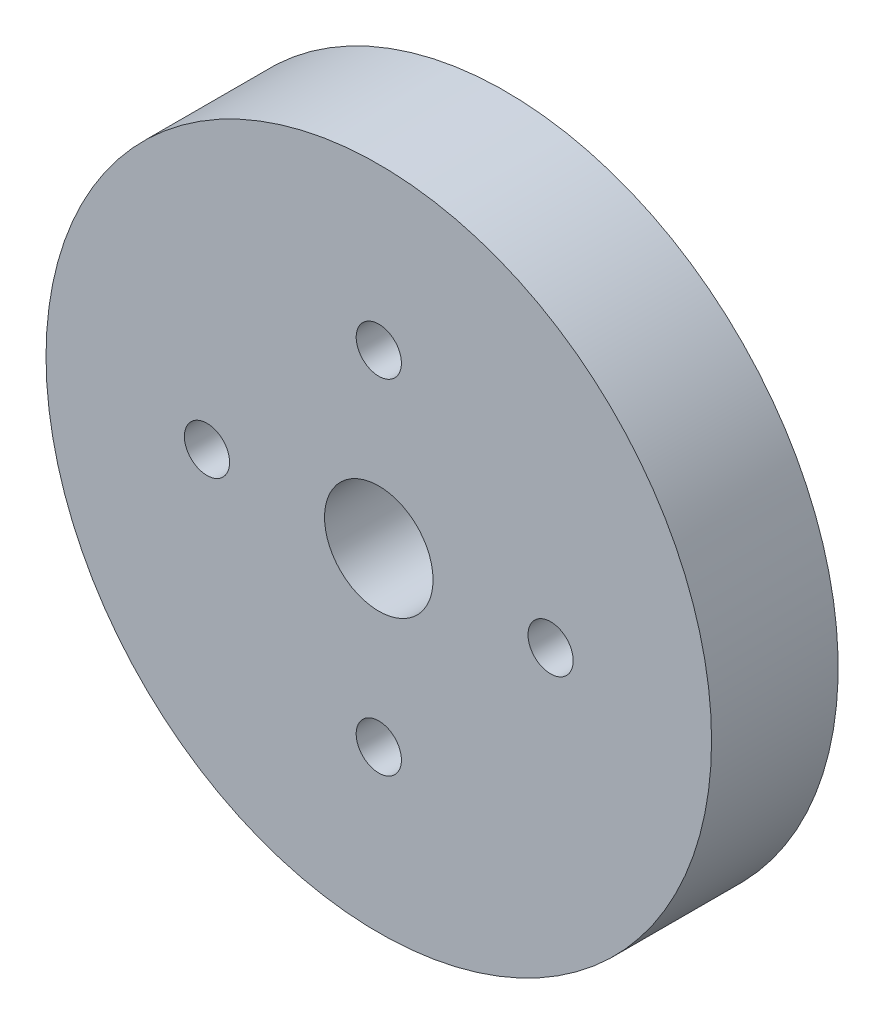
from build123d import *

# Parameters (mm, degrees)
CROQUIS1_R              = 18.4
SALIENTE_EXTRUIR1_DEPTH = 26.3
CROQUIS2_R              = 3
CROQUIS2_R_2            = 1.25
CORTAR_EXTRUIR1_DEPTH   = 5
CROQUIS3_R              = 1.25
CORTAR_EXTRUIR2_DEPTH   = 5
CROQUIS7_R              = 18.4
CORTAR_EXTRUIR5_DEPTH   = 19.3
CROQUIS8_R              = 6
CORTAR_EXTRUIR6_DEPTH   = 1


with BuildPart() as part:
    # Croquis1 → Saliente-Extruir1 (new body)
    with BuildSketch(Plane.XY):
        Circle(CROQUIS1_R)
    extrude(amount=SALIENTE_EXTRUIR1_DEPTH)

    # Croquis2 → Cortar-Extruir1 (cut)
    with BuildSketch(Plane.XY.offset(26.3)):
        Circle(CROQUIS2_R)
        with Locations((0, 9.5)):
            Circle(CROQUIS2_R_2)
        with Locations((9.5, 0)):
            Circle(CROQUIS2_R_2)
        with Locations((0, -9.5)):
            Circle(CROQUIS2_R_2)
        with Locations((-9.5, 0)):
            Circle(CROQUIS2_R_2)
    extrude(amount=-CORTAR_EXTRUIR1_DEPTH, mode=Mode.SUBTRACT)

    # Croquis3 → Cortar-Extruir2 (cut)
    with BuildSketch(Plane(origin=(0, 0, 0), x_dir=(-1, 0, 0), z_dir=(0, 0, -1))):
        with Locations((-10, 0)):
            Circle(CROQUIS3_R)
        with Locations((0, 10)):
            Circle(CROQUIS3_R)
        with Locations((10, 0)):
            Circle(CROQUIS3_R)
        with Locations((0, -10)):
            Circle(CROQUIS3_R)
    extrude(amount=-CORTAR_EXTRUIR2_DEPTH, mode=Mode.SUBTRACT)

    # Croquis7 → Cortar-Extruir5 (cut)
    with BuildSketch(Plane(origin=(0, 0, 0), x_dir=(-1, 0, 0), z_dir=(0, 0, -1))):
        Circle(CROQUIS7_R)
    extrude(amount=-CORTAR_EXTRUIR5_DEPTH, mode=Mode.SUBTRACT)

    # Croquis8 → Cortar-Extruir6 (cut)
    with BuildSketch(Plane(origin=(0, 0, 19.3), x_dir=(-1, 0, 0), z_dir=(0, 0, -1))):
        Circle(CROQUIS8_R)
    extrude(amount=-CORTAR_EXTRUIR6_DEPTH, mode=Mode.SUBTRACT)


solid = part.part
